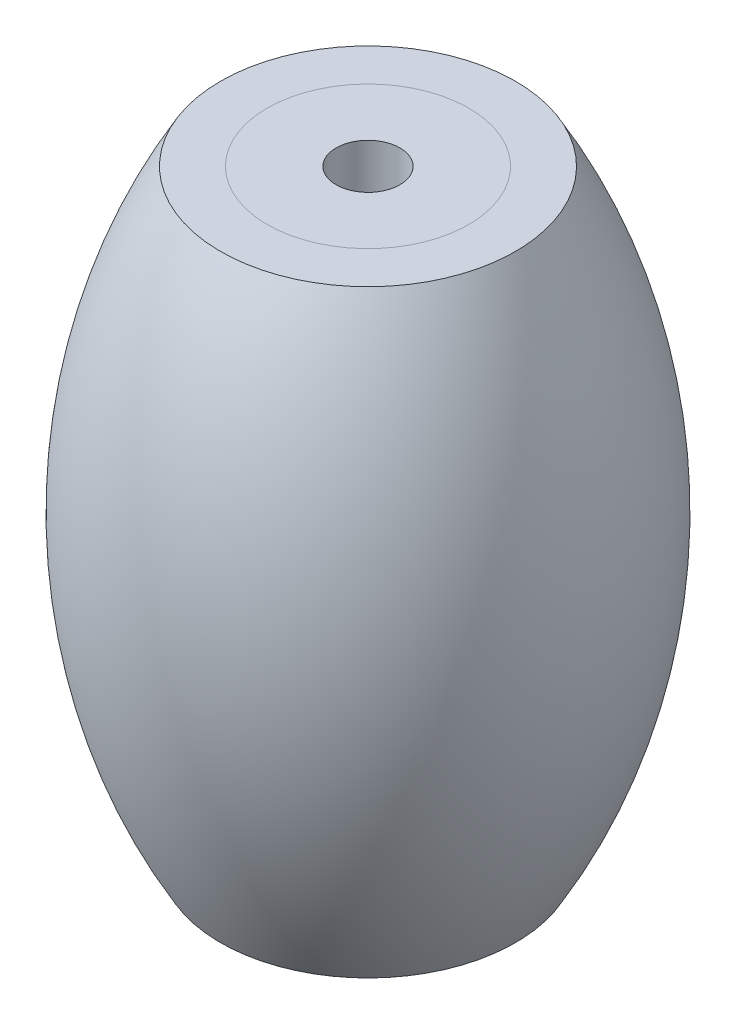
from build123d import *


with BuildPart() as part:
    # Sketch1 → Interior (revolve)
    with BuildSketch(Plane.XY):
        with BuildLine():
            Line((-2.526209361, -7.5), (-0.8, -7.5))
            Line((-0.8, -7.5), (-0.8, 7.5))
            Line((-0.8, 7.5), (-2.526209361, 7.5))
            ThreePointArc((-2.526209361, 7.5), (-4.704618943, 0), (-2.526209361, -7.5))
        make_face()
    revolve(axis=Axis((0, 7.5, 0), (0, -1, 0)))


with BuildPart() as body_2:
    # Sketch1<3> → Exterior (revolve)
    with BuildSketch(Plane.XY):
        with BuildLine():
            Line((-3.695, -7.5), (-2.526209361, -7.5))
            ThreePointArc((-2.526209361, -7.5), (-4.704618943, 0), (-2.526209361, 7.5))
            Line((-2.526209361, 7.5), (-3.695, 7.5))
            ThreePointArc((-3.695, 7.5), (-5.704618943, 0), (-3.695, -7.5))
        make_face()
    revolve(axis=Axis((0, 7.5, 0), (0, -1, 0)))


solid = Compound([part.part, body_2.part])
